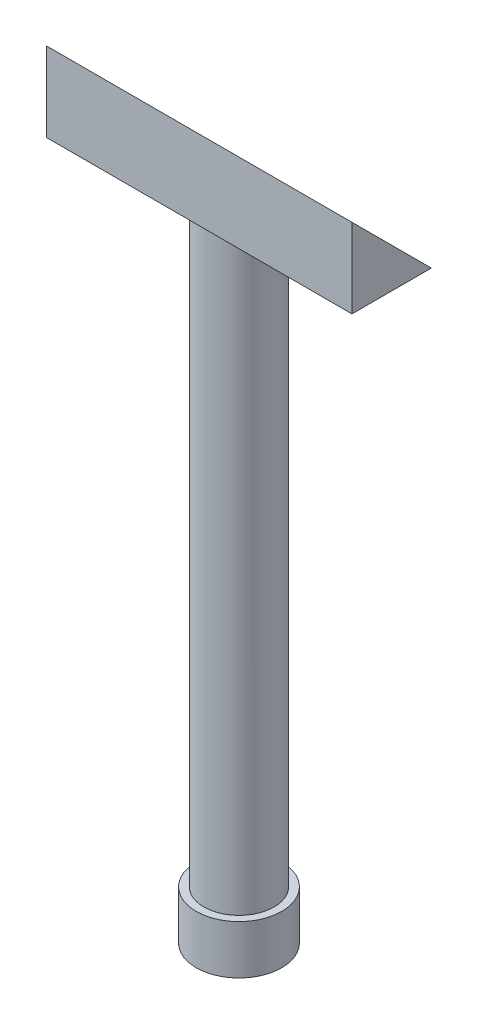
from build123d import *

# Parameters (mm, degrees)
SKETCH1_R            = 7
SKETCH1_R_2          = 4
BOSS_EXTRUDE1_DEPTH  = 8
SKETCH1_3_R          = 4.75
SKETCH1_3_R_2        = 4
BOSS_EXTRUDE2_DEPTH  = 80
SKETCH3_R            = 5.75
SKETCH3_R_2          = 3.05
BOSS_EXTRUDE3_DEPTH  = 105
SKETCH8_W            = 50
SKETCH8_H            = 13
BOSS_EXTRUDE8_DEPTH  = 4
SKETCH9_W            = 50
SKETCH9_H            = 6.245985434
BOSS_EXTRUDE9_DEPTH  = 9
BOSS_EXTRUDE10_DEPTH = 50
SKETCH11_W           = 50
SKETCH11_H           = 12.98265639
BOSS_EXTRUDE11_DEPTH = 10
CUT_EXTRUDE1_DEPTH   = 100
SKETCH13_W           = 50
SKETCH13_H           = 13
BOSS_EXTRUDE12_DEPTH = 13
CUT_EXTRUDE2_DEPTH   = 50
CUT_EXTRUDE3_DEPTH   = 50


with BuildPart() as part:
    # Sketch1 → Boss-Extrude1 (new body)
    with BuildSketch(Plane(origin=(0, 0, 0), x_dir=(1, 0, 0), z_dir=(0, 1, 0))):
        Circle(SKETCH1_R)
        Circle(SKETCH1_R_2, mode=Mode.SUBTRACT)
    extrude(amount=BOSS_EXTRUDE1_DEPTH)

    # Sketch1<3> → Boss-Extrude2 (add)
    with BuildSketch(Plane(origin=(0, 0, 0), x_dir=(1, 0, 0), z_dir=(0, 1, 0))):
        Circle(SKETCH1_3_R)
        Circle(SKETCH1_3_R_2, mode=Mode.SUBTRACT)
    extrude(amount=BOSS_EXTRUDE2_DEPTH)

    # Sketch3 → Boss-Extrude3 (add)
    with BuildSketch(Plane.XZ):
        Circle(SKETCH3_R)
        Circle(SKETCH3_R_2, mode=Mode.SUBTRACT)
    extrude(amount=-BOSS_EXTRUDE3_DEPTH)

    # Sketch8 → Boss-Extrude8 (add)
    with BuildSketch(Plane(origin=(0, 105, 0), x_dir=(1, 0, 0), z_dir=(0, 1, 0))):
        Rectangle(SKETCH8_W, SKETCH8_H)
    extrude(amount=BOSS_EXTRUDE8_DEPTH)

    # Sketch9 → Boss-Extrude9 (add)
    with BuildSketch(Plane(origin=(0, 109, 0), x_dir=(1, 0, 0), z_dir=(0, 1, 0))):
        with Locations((0, -3.377007283)):
            Rectangle(SKETCH9_W, SKETCH9_H)
    extrude(amount=BOSS_EXTRUDE9_DEPTH)

    # Sketch10 → Boss-Extrude10 (add)
    with BuildSketch(Plane.ZY.offset(25)):
        with BuildLine():
            Line((0.254014566, 118), (0.254014566, 109))
            Line((0.254014566, 109), (-6.5, 109))
            ThreePointArc((-6.5, 109), (-4.986953748, 114.898802217), (0.254014566, 118))
        make_face()
    extrude(amount=-BOSS_EXTRUDE10_DEPTH)

    # Sketch11 → Boss-Extrude11 (add)
    with BuildSketch(Plane(origin=(0, 118, 0), x_dir=(1, 0, 0), z_dir=(0, 1, 0))):
        Rectangle(SKETCH11_W, SKETCH11_H)
    extrude(amount=-BOSS_EXTRUDE11_DEPTH)

    # Sketch12 → Cut-Extrude1 (cut)
    with BuildSketch(Plane(origin=(0, 0, -6.491328195), x_dir=(-1, 0, 0), z_dir=(0, 0, -1))):
        with BuildLine():
            Line((-25, 118), (25, 118))
            ThreePointArc((25, 118), (0, 116.124221553), (-25, 118))
        make_face()
    extrude(amount=-CUT_EXTRUDE1_DEPTH, mode=Mode.SUBTRACT)

    # Sketch13 → Boss-Extrude12 (add)
    with BuildSketch(Plane.XZ.offset(-105)):
        Rectangle(SKETCH13_W, SKETCH13_H)
    extrude(amount=-BOSS_EXTRUDE12_DEPTH)

    # Sketch14 → Cut-Extrude2 (cut)
    with BuildSketch(Plane.ZY.offset(25)):
        Polygon((-6.5, 105), (6.5, 118), (-6.5, 118), (-6.5, 107), align=None)
    extrude(amount=-CUT_EXTRUDE2_DEPTH, mode=Mode.SUBTRACT)


with BuildPart() as cut_extrude2_piece_1:
    # of the separate pieces the step leaves, piece 1, a body of its own (cut_extrude2_pieces)
    add(part.part.solids().sort_by_distance((-25, 105, -6.5))[0])


with BuildPart() as cut_extrude2_piece_2:
    # of the separate pieces the step leaves, piece 2, a body of its own (cut_extrude2_pieces)
    add(part.part.solids().sort_by_distance((-25, 109, -6.5))[0])

    # Sketch15 → Cut-Extrude3 (cut)
    with BuildSketch(Plane.ZY.offset(25)):
        with BuildLine():
            Line((6.5, 118), (-6.5, 105))
            Line((-6.5, 105), (-15.046764463, 116.293960334))
            Line((-15.046764463, 116.293960334), (5.81150646, 117.953140975))
            ThreePointArc((5.81150646, 117.953140975), (6.155619412, 117.978536655), (6.5, 118))
        make_face()
    extrude(amount=-CUT_EXTRUDE3_DEPTH, mode=Mode.SUBTRACT)


solid = cut_extrude2_piece_1.part
